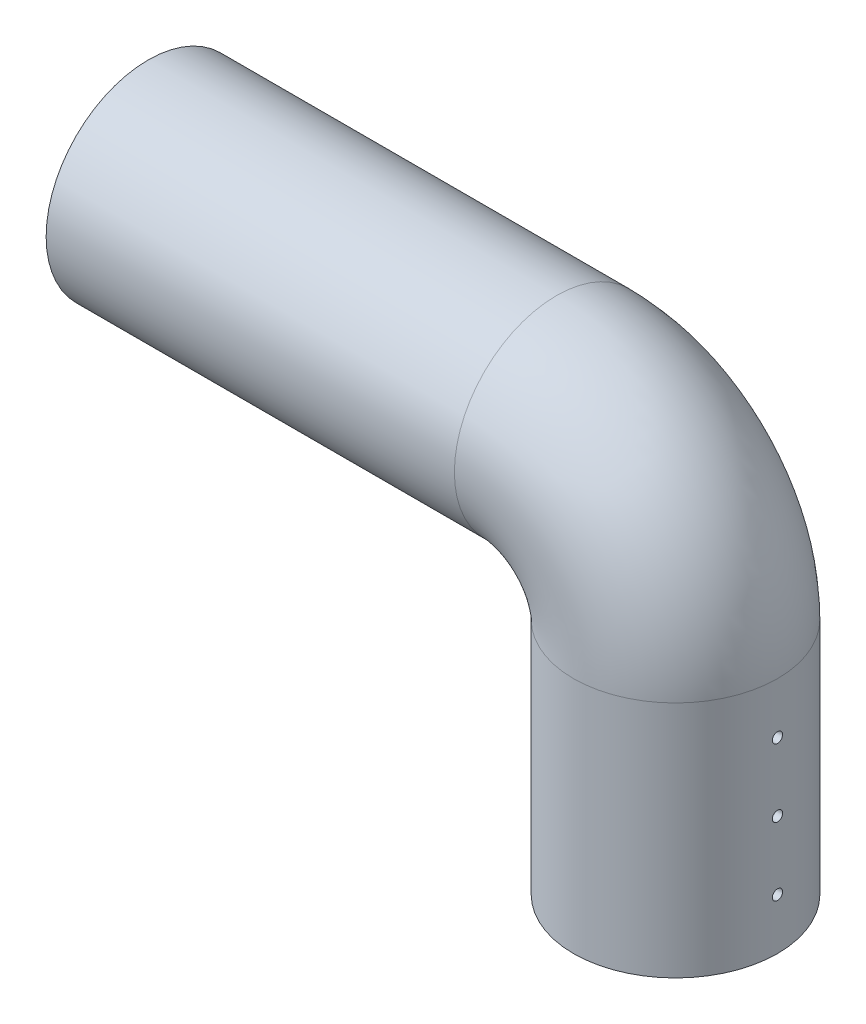
from build123d import *

# Parameters (mm, degrees)
SKETCH2_R               = 30
SHELL15_T               = -9
CUT_EXTRUDE2_DEPTH      = 184.113665481
CUT_EXTRUDE2_DEPTH_BACK = 184.113665481
SKETCH4_R               = 1.5


with BuildPart() as part:
    # Sweep1: sweep along a path in Sketch1
    with BuildLine(Plane.XY) as sweep1_path:
        Line((34.976608727, 0), (34.976608727, 70))
        ThreePointArc((34.976608727, 70), (24.725346068, 94.748737342), (-0.023391273, 105))
        Line((-0.023391273, 105), (-120.023391273, 105))
    # Sketch2 → Sweep1 (sweep)
    with BuildSketch(Plane(origin=(0, 0, 0), x_dir=(1, 0, 0), z_dir=(0, 1, 0))):
        with Locations((34.976608727, 0)):
            Circle(SKETCH2_R)
    sweep(path=sweep1_path.line)

    # Shell15
    shell15_openings = [part.faces().sort_by_distance(p)[0] for p in [
        (-120.023391273, 105, 0),
        (34.976608727, 0, 0),
    ]]
    offset(amount=SHELL15_T, openings=shell15_openings, kind=Kind.INTERSECTION)

    # Sketch4 → Cut-Extrude2 (cut, two sides: drawn at the far end of the back side and taken through both)
    with BuildSketch(Plane(origin=(0, 0, 0), x_dir=(0, 0, -1), z_dir=(1, 0, 0)).offset(-CUT_EXTRUDE2_DEPTH_BACK)):
        with Locations((0, 35)):
            Circle(SKETCH4_R)
        with Locations((0, 55)):
            Circle(SKETCH4_R)
        with Locations((0, 15)):
            Circle(SKETCH4_R)
    extrude(amount=CUT_EXTRUDE2_DEPTH + CUT_EXTRUDE2_DEPTH_BACK, mode=Mode.SUBTRACT)


solid = part.part
